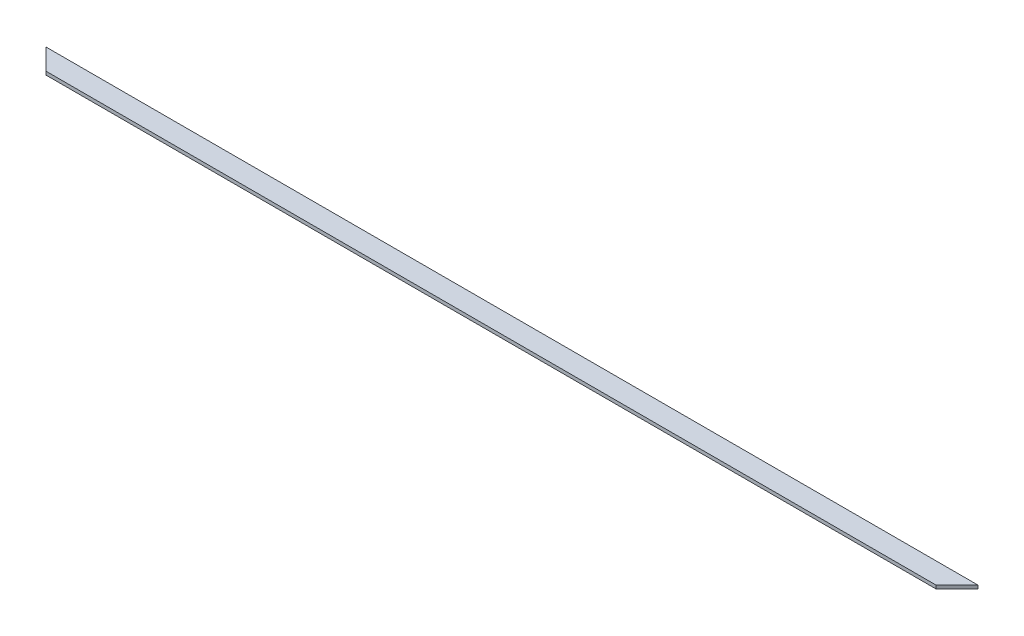
from build123d import *

# Parameters (mm, degrees)
BOSS_EXTRUDE1_DEPTH = 21.59


with BuildPart() as part:
    # Sketch1 → Boss-Extrude1 (new body)
    with BuildSketch(Plane(origin=(0, 0, 0), x_dir=(1, 0, 0), z_dir=(0, 1, 0))):
        Polygon((-2702.637755102, 921.397959184), (3228.262244898, 921.397959184), (3094.912244898, 788.047959184), (-2569.287755102, 788.047959184), align=None)
    extrude(amount=BOSS_EXTRUDE1_DEPTH)


solid = part.part
